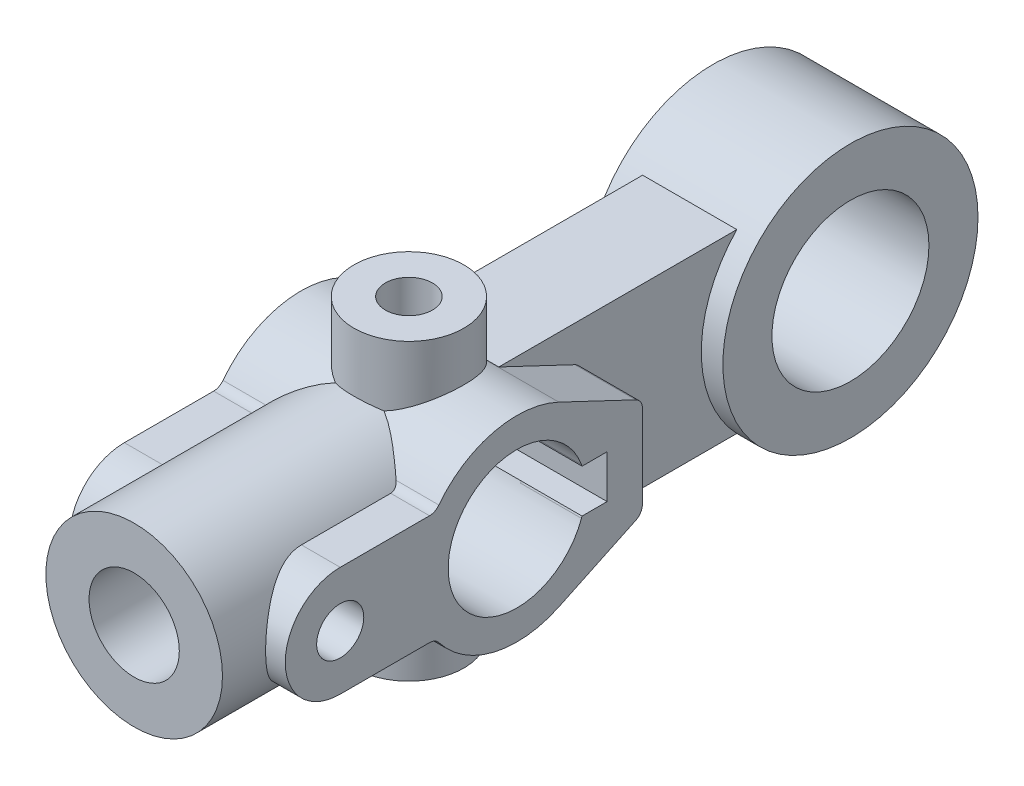
from build123d import *
from build123d.topology import SkipClean

# Parameters (mm, degrees)
BOSS_EXTRUDE1_DEPTH              = 70
BOSS_EXTRUDE3_REACH              = 84.538
BOSS_EXTRUDE3_END_RADIUS         = 22.5
CUT_EXTRUDE1_DEPTH               = 70
BOSS_EXTRUDE4_REACH              = 95.842
CUT_EXTRUDE2_DEPTH               = 70
BOSS_EXTRUDE5_REACH              = 98.598
BOSS_EXTRUDE6_START              = -35
SKETCH8_R                        = 22.5
SKETCH8_R_2                      = 11.5
BOSS_EXTRUDE6_DEPTH              = 35
BOSS_EXTRUDE7_REACH              = 98.209
BOSS_EXTRUDE8_REACH              = 98.598
CUT_EXTRUDE3_DEPTH               = 97.5983956
CUT_EXTRUDE3_DEPTH_BACK          = 97.5983956
SKETCH13_R                       = 6
CUT_EXTRUDE4_DEPTH               = 32
CUT_EXTRUDE5_DEPTH               = 115.836840927
CUT_EXTRUDE6_DEPTH               = 21
SKETCH16_R                       = 32.5
SKETCH16_R_2                     = 20
BOSS_EXTRUDE9_DEPTH              = 45
SKETCH18_R                       = 32.5
SKETCH18_R_2                     = 20
CUT_EXTRUDE7_DEPTH               = 10
BOSS_EXTRUDE10_REACH             = 124.657
BOSS_EXTRUDE10_DIRECTION_2_DEPTH = 14
BOSS_EXTRUDE11_REACH             = 145.831
CUT_EXTRUDE10_DEPTH              = 136.715695529
CUT_EXTRUDE10_DEPTH_BACK         = 136.715695529
CUT_EXTRUDE11_DEPTH              = 136.715695529
CUT_EXTRUDE11_DEPTH_BACK         = 136.715695529
SKETCH24_R                       = 6
CUT_EXTRUDE12_DEPTH              = 136.715695529
CUT_EXTRUDE12_DEPTH_BACK         = 136.715695529
BOSS_EXTRUDE12_DEPTH             = 15.5


with BuildPart() as part:
    # Sketch1 → Boss-Extrude1 (new body)
    with BuildSketch(Plane.XY):
        with BuildLine():
            Line((-11.5, 0), (-22.5, 0))
            ThreePointArc((-22.5, 0), (0, 22.5), (22.5, 0))
            Line((22.5, 0), (11.5, 0))
            ThreePointArc((11.5, 0), (0, 11.5), (-11.5, 0))
        make_face()
    extrude(amount=BOSS_EXTRUDE1_DEPTH)

    # Boss-Extrude3: up to this cylinder (the profile starts outside it)
    boss_extrude3_end = Plane(origin=(0, 0, 6.705728), z_dir=(0, 0, -1)) * Cylinder(BOSS_EXTRUDE3_END_RADIUS, 215.076, mode=Mode.PRIVATE)
    # Sketch2 → Boss-Extrude3 (add, up to the surface)
    with BuildSketch(Plane(origin=(0, 37.5, 0), x_dir=(1, 0, 0), z_dir=(0, 1, 0)), mode=Mode.PRIVATE) as boss_extrude3_sk1:
        with BuildLine():
            Line((14, 0), (6, 0))
            ThreePointArc((6, 0), (0, -6), (-6, 0))
            Line((-6, 0), (-14, 0))
            ThreePointArc((-14, 0), (0, -14), (14, 0))
        make_face()
    boss_extrude3_tool1 = extrude(boss_extrude3_sk1.sketch, amount=-BOSS_EXTRUDE3_REACH, mode=Mode.PRIVATE) - boss_extrude3_end
    add(boss_extrude3_tool1.solids().sort_by_distance((0, 37.5, 6.705728))[0])

    # Sketch4 → Cut-Extrude1 (cut)
    with BuildSketch(Plane(origin=(0, 37.5, 0), x_dir=(1, 0, 0), z_dir=(0, 1, 0))):
        with BuildLine():
            Line((6, 0), (-6, 0))
            ThreePointArc((-6, 0), (0, -6), (6, 0))
        make_face()
    extrude(amount=-CUT_EXTRUDE1_DEPTH, mode=Mode.SUBTRACT)

    # Sketch5 → Boss-Extrude4 (add, up to next)
    with BuildSketch(Plane(origin=(27.5, 0, 0), x_dir=(0, 0, -1), z_dir=(1, 0, 0)), mode=Mode.PRIVATE) as boss_extrude4_sk1:
        with BuildLine():
            Line((-45, 14), (-22.248595461, 14))
            ThreePointArc((-22.248595461, 14), (-20.918987571, 14.310735629), (-19.864817376, 15.178571429))
            ThreePointArc((-19.864817376, 15.178571429), (-11.080065755, 22.410536425), (0, 25))
            Line((0, 25), (0, 17.5))
            ThreePointArc((0, 17.5), (-12.374368671, 12.374368671), (-17.5, 0))
            Line((-17.5, 0), (-39, 0))
            ThreePointArc((-39, 0), (-45, 6), (-51, 0))
            Line((-51, 0), (-59, 0))
            ThreePointArc((-59, 0), (-54.899494937, 9.899494937), (-45, 14))
        make_face()
    boss_extrude4_tool1 = extrude(boss_extrude4_sk1.sketch, amount=-BOSS_EXTRUDE4_REACH, mode=Mode.PRIVATE) - part.part
    add(boss_extrude4_tool1.solids().sort_by_distance((27.5, 9.826171, 29.325253))[0])

    # Sketch6 → Cut-Extrude2 (cut)
    with BuildSketch(Plane(origin=(27.5, 0, 0), x_dir=(0, 0, -1), z_dir=(1, 0, 0))):
        with BuildLine():
            Line((0, 0), (0, 17.5))
            ThreePointArc((0, 17.5), (-12.374368671, 12.374368671), (-17.5, 0))
            Line((-17.5, 0), (0, 0))
        make_face()
        with BuildLine():
            Line((-51, 0), (-39, 0))
            ThreePointArc((-39, 0), (-45, 6), (-51, 0))
        make_face()
    extrude(amount=-CUT_EXTRUDE2_DEPTH, mode=Mode.SUBTRACT)

    # Sketch7 → Boss-Extrude5 (add, up to next)
    with BuildSketch(Plane(origin=(-27.5, 0, 0), x_dir=(0, 0, -1), z_dir=(1, 0, 0)), mode=Mode.PRIVATE) as boss_extrude5_sk1:
        with BuildLine():
            Line((-45, 14), (-22.248595461, 14))
            ThreePointArc((-22.248595461, 14), (-20.918987571, 14.310735629), (-19.864817376, 15.178571429))
            ThreePointArc((-19.864817376, 15.178571429), (-11.080065755, 22.410536425), (0, 25))
            Line((0, 25), (0, 17.5))
            ThreePointArc((0, 17.5), (-12.374368671, 12.374368671), (-17.5, 0))
            Line((-17.5, 0), (-25, 0))
            Line((-25, 0), (-31, 0))
            Line((-31, 0), (-39, 0))
            ThreePointArc((-39, 0), (-45, 6), (-51, 0))
            Line((-51, 0), (-59, 0))
            ThreePointArc((-59, 0), (-54.899494937, 9.899494937), (-45, 14))
        make_face()
    boss_extrude5_tool1 = extrude(boss_extrude5_sk1.sketch, amount=BOSS_EXTRUDE5_REACH, mode=Mode.PRIVATE) - part.part
    add(boss_extrude5_tool1.solids().sort_by_distance((-27.5, 9.826171, 29.325253))[0])

    # Sketch8 → Boss-Extrude6 (add)
    with BuildSketch(Plane.XY.offset(BOSS_EXTRUDE6_START)):
        Circle(SKETCH8_R)
        Circle(SKETCH8_R_2, mode=Mode.SUBTRACT)
    extrude(amount=BOSS_EXTRUDE6_DEPTH)

    # Sketch10 → Boss-Extrude7 (add, up to next)
    with BuildSketch(Plane(origin=(0, 37.5, 0), x_dir=(1, 0, 0), z_dir=(0, 1, 0)), mode=Mode.PRIVATE) as boss_extrude7_sk1:
        with BuildLine():
            Line((-14, 0), (-6, 0))
            ThreePointArc((-6, 0), (0, 6), (6, 0))
            Line((6, 0), (14, 0))
            ThreePointArc((14, 0), (0, 14), (-14, 0))
        make_face()
    boss_extrude7_tool1 = extrude(boss_extrude7_sk1.sketch, amount=-BOSS_EXTRUDE7_REACH, mode=Mode.PRIVATE) - part.part
    add(boss_extrude7_tool1.solids().sort_by_distance((0, 37.5, -6.705728))[0])

    # Sketch9 → Boss-Extrude8 (add, up to next)
    with BuildSketch(Plane(origin=(-27.5, 0, 0), x_dir=(0, 0, -1), z_dir=(1, 0, 0)), mode=Mode.PRIVATE) as boss_extrude8_sk1:
        with BuildLine():
            Line((0, 17.5), (0, 25))
            ThreePointArc((0, 25), (5.48701166, 24.390422363), (10.706442552, 22.591416244))
            Line((10.706442552, 22.591416244), (30.284792554, 13.312915184))
            ThreePointArc((30.284792554, 13.312915184), (31.535203792, 12.205952822), (32.000019448, 10.601945235))
            Line((32.000019448, 10.601945235), (32.000019448, 0))
            Line((32.000019448, 0), (23, 0))
            Line((23, 0), (23, 5.5))
            Line((23, 5.5), (16.613247726, 5.5))
            ThreePointArc((16.613247726, 5.5), (10.246950766, 14.186260959), (0, 17.5))
        make_face()
    boss_extrude8_tool1 = extrude(boss_extrude8_sk1.sketch, amount=BOSS_EXTRUDE8_REACH, mode=Mode.PRIVATE) - part.part
    add(boss_extrude8_tool1.solids().sort_by_distance((-27.5, 12.853716, -18.105631))[0])

    # Sketch12 → Cut-Extrude3 (cut, two sides: drawn at the far end of the back side and taken through both)
    with SkipClean():  # the faces are left unmerged after this step: merging them gives an invalid solid
        with BuildSketch(Plane(origin=(-27.5, 0, 0), x_dir=(0, 0, -1), z_dir=(1, 0, 0)).offset(-CUT_EXTRUDE3_DEPTH_BACK)):
            with BuildLine():
                Line((16.613247726, 5.5), (23, 5.5))
                Line((23, 5.5), (23, 0))
                Line((23, 0), (17.5, 0))
                ThreePointArc((17.5, 0), (-17.276889697, -2.785512951), (16.613247726, 5.5))
            make_face()
        extrude(amount=CUT_EXTRUDE3_DEPTH + CUT_EXTRUDE3_DEPTH_BACK, mode=Mode.SUBTRACT)

    # Sketch13 → Cut-Extrude4 (cut)
    with SkipClean():  # the faces are left unmerged after this step: merging them gives an invalid solid
        with BuildSketch(Plane(origin=(0, 37.5, 0), x_dir=(1, 0, 0), z_dir=(0, 1, 0))):
            with Locations(Location((0, 0, 0), (0, 0, 270))):
                Circle(SKETCH13_R)
        extrude(amount=-CUT_EXTRUDE4_DEPTH, mode=Mode.SUBTRACT)

    # Sketch14 → Cut-Extrude5 (cut, through all)
    with SkipClean():  # the faces are left unmerged after this step: merging them gives an invalid solid
        with BuildSketch(Plane(origin=(0, 0, -35), x_dir=(-1, 0, 0), z_dir=(0, 0, -1))):
            Polygon((0, 0), (34.519613676, 0), (34.519613676, -29.088750852), (-33.302394944, -29.088750852), (-33.302394944, 0), align=None)
        extrude(amount=-CUT_EXTRUDE5_DEPTH, mode=Mode.SUBTRACT)

    # Sketch15 → Cut-Extrude6 (cut)
    with SkipClean():  # the faces are left unmerged after this step: merging them gives an invalid solid
        with BuildSketch(Plane(origin=(0, 0, -35), x_dir=(-1, 0, 0), z_dir=(0, 0, -1))):
            with BuildLine():
                Line((-22.5, 0), (-11.5, 0))
                ThreePointArc((-11.5, 0), (0, 11.5), (11.5, 0))
                Line((11.5, 0), (22.5, 0))
                ThreePointArc((22.5, 0), (0, 22.5), (-22.5, 0))
            make_face()
        extrude(amount=-CUT_EXTRUDE6_DEPTH, mode=Mode.SUBTRACT)


with BuildPart() as body_2:
    # Sketch16 → Boss-Extrude9 (new body)
    with BuildSketch(Plane(origin=(27.5, 0, 0), x_dir=(0, 0, -1), z_dir=(1, 0, 0))):
        with Locations((95, 0)):
            Circle(SKETCH16_R)
        with Locations((95, 0)):
            Circle(SKETCH16_R_2, mode=Mode.SUBTRACT)
    extrude(amount=-BOSS_EXTRUDE9_DEPTH)

    # Sketch18 → Cut-Extrude7 (cut)
    with BuildSketch(Plane(origin=(27.5, 0, 0), x_dir=(0, 0, -1), z_dir=(1, 0, 0))):
        with Locations((95, 0)):
            Circle(SKETCH18_R)
        with Locations((95, 0)):
            Circle(SKETCH18_R_2, mode=Mode.SUBTRACT)
    extrude(amount=-CUT_EXTRUDE7_DEPTH, mode=Mode.SUBTRACT)

    # Sketch19 → Boss-Extrude10 (add, up to next)
    with BuildSketch(Plane(origin=(0, 0, -14), x_dir=(-1, 0, 0), z_dir=(0, 0, -1)), mode=Mode.PRIVATE) as boss_extrude10_sk1:
        Polygon((-12, 22.5), (0, 22.5), (12, 22.5), (12, 0), (-12, 0), align=None)
    boss_extrude10_tool1 = extrude(boss_extrude10_sk1.sketch, amount=BOSS_EXTRUDE10_REACH, mode=Mode.PRIVATE) - body_2.part

    add(part.part)  # Boss-Extrude10 merges part
    add(boss_extrude10_tool1.solids().sort_by_distance((0, 11.25, -14))[0])

    # Sketch19 → Boss-Extrude10 direction 2 (add)
    with SkipClean():  # the faces are left unmerged after this step: merging them gives an invalid solid
        with BuildSketch(Plane(origin=(0, 0, -14), x_dir=(-1, 0, 0), z_dir=(0, 0, -1))):
            Polygon((-12, 22.5), (0, 22.5), (12, 22.5), (12, 0), (-12, 0), align=None)
        extrude(amount=-BOSS_EXTRUDE10_DIRECTION_2_DEPTH)

    # Boss-Extrude11: up to this face of the body (flat: up to its plane)
    boss_extrude11_end = Plane(body_2.part.faces().sort_by_distance((-12, 11.539159183, -39.818858202))[0])
    # Sketch21 → Boss-Extrude11 (add, up to the picked face)
    with BuildSketch(Plane.ZY.offset(27.5), mode=Mode.PRIVATE) as boss_extrude11_sk1:
        with BuildLine():
            Line((-23, 0), (-32.000019448, 0))
            Line((-32.000019448, 0), (-32.000019448, 10.601945235))
            Line((-32.000019448, 10.601945235), (-30.284792554, 13.312915184))
            Line((-30.284792554, 13.312915184), (-10.706442552, 22.591416244))
            ThreePointArc((-10.706442552, 22.591416244), (-5.48701166, 24.390422363), (0, 25))
            Line((0, 25), (0, 17.5))
            ThreePointArc((0, 17.5), (-10.246950766, 14.186260959), (-16.613247726, 5.5))
            Line((-16.613247726, 5.5), (-23, 5.5))
            Line((-23, 5.5), (-23, 0))
        make_face()
    boss_extrude11_tool1 = split(extrude(boss_extrude11_sk1.sketch, amount=-BOSS_EXTRUDE11_REACH, mode=Mode.PRIVATE), bisect_by=boss_extrude11_end, keep=Keep.BOTH, mode=Mode.PRIVATE)
    add(boss_extrude11_tool1.solids().sort_by(Axis((-27.5, 12.855958, -18.068469), (1, 0, 0)))[0])

    # Sketch22 → Cut-Extrude10 (cut, two sides: drawn at the far end of the back side and taken through both)
    with SkipClean():  # the faces are left unmerged after this step: merging them gives an invalid solid
        with BuildSketch(Plane.XY.offset(-CUT_EXTRUDE10_DEPTH_BACK)):
            Polygon((32.236712511, 0), (32.236712511, -39.849949401), (-33.052219216, -39.849949401), (-33.052219216, 0), (0, 0), (0, 50.053061176), (32.236712511, 50.053061176), align=None)
        extrude(amount=CUT_EXTRUDE10_DEPTH + CUT_EXTRUDE10_DEPTH_BACK, mode=Mode.SUBTRACT)

    # Sketch24 → Cut-Extrude11 (cut, two sides: drawn at the far end of the back side and taken through both)
    with SkipClean():  # the faces are left unmerged after this step: merging them gives an invalid solid
        with BuildSketch(Plane(origin=(0, 37.5, 0), x_dir=(1, 0, 0), z_dir=(0, 1, 0)).offset(-CUT_EXTRUDE11_DEPTH_BACK)):
            Circle(SKETCH24_R)
        extrude(amount=CUT_EXTRUDE11_DEPTH + CUT_EXTRUDE11_DEPTH_BACK, mode=Mode.SUBTRACT)

    # Sketch25 → Cut-Extrude12 (cut, two sides: drawn at the far end of the back side and taken through both)
    with SkipClean():  # the faces are left unmerged after this step: merging them gives an invalid solid
        with BuildSketch(Plane.ZY.offset(27.5).offset(-CUT_EXTRUDE12_DEPTH_BACK)):
            with BuildLine():
                Line((-23, 0), (-23, 5.5))
                Line((-23, 5.5), (-16.613247726, 5.5))
                ThreePointArc((-16.613247726, 5.5), (-10.246950766, 14.186260959), (0, 17.5))
                Line((0, 17.5), (0, 0))
                Line((0, 0), (-23, 0))
            make_face()
        extrude(amount=CUT_EXTRUDE12_DEPTH + CUT_EXTRUDE12_DEPTH_BACK, mode=Mode.SUBTRACT)

    # Sketch26 → Boss-Extrude12 (add)
    with SkipClean():  # the faces are left unmerged after this step: merging them gives an invalid solid
        with BuildSketch(Plane.ZY.offset(27.5)):
            with BuildLine():
                Line((-32.000019448, 0), (-32.000019448, 10.601945235))
                ThreePointArc((-32.000019448, 10.601945235), (-31.535203792, 12.205952822), (-30.284792554, 13.312915184))
                Line((-30.284792554, 13.312915184), (-10.706442552, 22.591416244))
                Line((-10.706442552, 22.591416244), (-16.613247726, 5.5))
                Line((-16.613247726, 5.5), (-23, 5.5))
                Line((-23, 5.5), (-23, 0))
                Line((-23, 0), (-32.000019448, 0))
            make_face()
        extrude(amount=-BOSS_EXTRUDE12_DEPTH)

    # Mirror1: body 2 across plane


with BuildPart() as body_2_1:
    with SkipClean():  # the faces are left unmerged after this step: merging them gives an invalid solid
        add(body_2.part)
        add(body_2.part.mirror(Plane(origin=(27.502, 0, -23), x_dir=(0, 0, 1), z_dir=(0, 1, 0))))

    # Mirror2: body 2 across plane


with BuildPart() as body_2_2:
    with SkipClean():  # the faces are left unmerged after this step: merging them gives an invalid solid
        add(body_2_1.part)
        add(body_2_1.part.mirror(Plane(origin=(0, 0, -127.5), x_dir=(0, 0, 1), z_dir=(-1, 0, 0))))


solid = body_2_2.part
